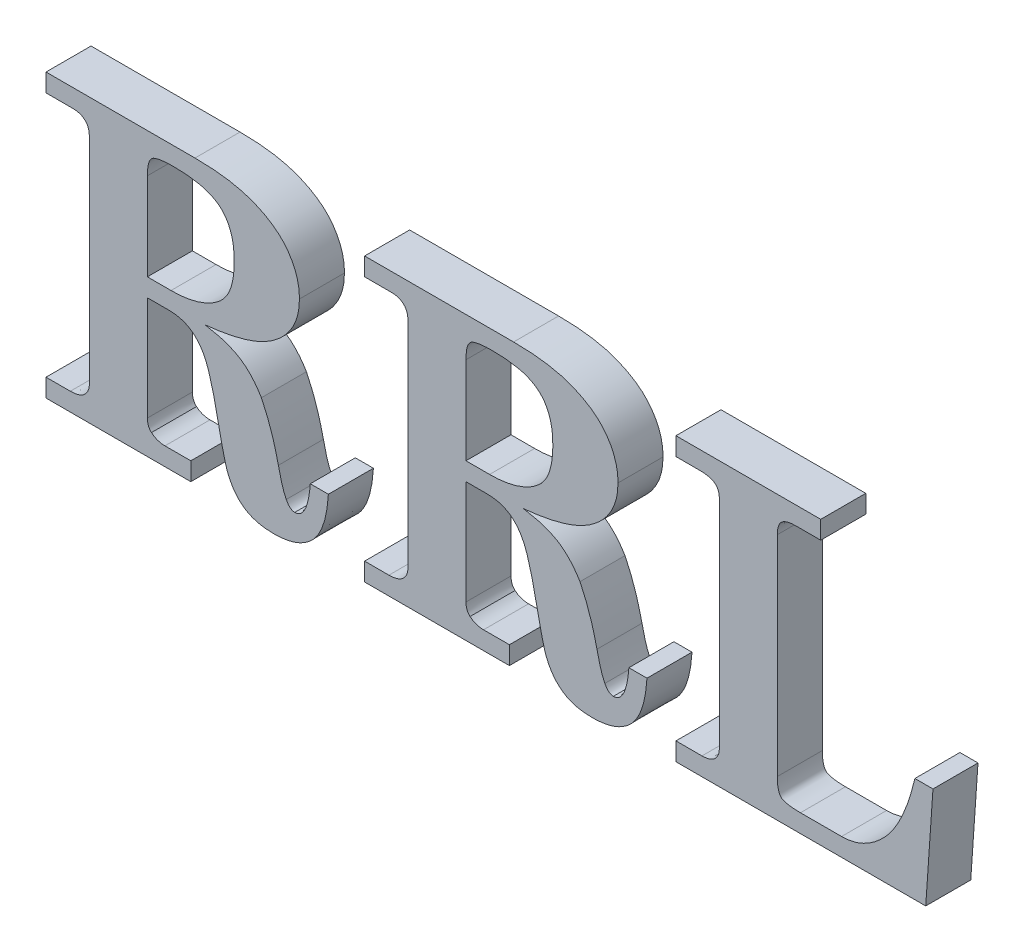
from build123d import *

# Parameters (mm, degrees)
BOSS_EXTRUDE3_DEPTH   = 1.5
BOSS_EXTRUDE3_2_DEPTH = 1.5
BOSS_EXTRUDE3_3_DEPTH = 1.5


with BuildPart() as part:
    # Sketch1 → Boss-Extrude3 (new body)
    with BuildSketch(Plane.XY):
        with BuildLine():
            Line((-17.792306251, 4.694080364), (-12.828663192, 4.694080364))
            add(Edge.make_bspline(
                [(-12.828663192, 4.694080364), (-12.730035048, 4.69268479), (-12.537718263, 4.689963537), (-12.255982797, 4.677801675), (-11.988242483, 4.652805171), (-11.734140511, 4.619512844), (-11.494538517, 4.576171505), (-11.268883087, 4.524225789), (-11.058145121, 4.459104871), (-10.859253477, 4.388590104), (-10.675069792, 4.306712483), (-10.502222733, 4.220179261), (-10.341607342, 4.125844226), (-10.193150347, 4.024321409), (-10.056235222, 3.916981361), (-9.933227506, 3.801062135), (-9.821480356, 3.678346195), (-9.690024752, 3.506695514), (-9.553302789, 3.27955363), (-9.434395722, 2.988775318), (-9.362262286, 2.682490406), (-9.354091978, 2.472696616), (-9.349967259, 2.366783789)],
                knots=[0, 0, 0, 0, 1.260796864, 2.458450407, 3.603348749, 4.696868034, 5.733149247, 6.714703153, 7.654483761, 8.551049231, 9.410311666, 10.229003047, 11.020794849, 11.789116025, 12.526438116, 13.242153704, 13.946977727, 14.645554491, 16.003253973, 17.321296627, 18.647676625, 20, 20, 20, 20], degree=3))
            add(Edge.make_bspline(
                [(-9.349967259, 2.366783789), (-9.352915115, 2.282421282), (-9.358718846, 2.116328606), (-9.403198523, 1.873029201), (-9.475953273, 1.64181479), (-9.582018071, 1.42477804), (-9.714914574, 1.219244817), (-9.87845062, 1.026431585), (-10.071550114, 0.846279243), (-10.217451803, 0.741442678), (-10.292192593, 0.687738244)],
                knots=[0, 0, 0, 0, 1.006615866, 1.981822625, 2.942272039, 3.891414032, 4.85650664, 5.856958922, 6.902188287, 8, 8, 8, 8], degree=3))
            add(Edge.make_bspline(
                [(-10.292192593, 0.687738244), (-10.354945799, 0.647601368), (-10.485662323, 0.563995235), (-10.702597759, 0.458250221), (-10.943901912, 0.36445614), (-11.208356068, 0.280038352), (-11.496402328, 0.204938979), (-11.809041036, 0.141087064), (-12.145504873, 0.08850756), (-12.378782769, 0.063611491), (-12.498884325, 0.050793918)],
                knots=[0, 0, 0, 0, 0.770522959, 1.605018928, 2.492419048, 3.448517842, 4.476706657, 5.572020456, 6.749971061, 8, 8, 8, 8], degree=3))
            add(Edge.make_bspline(
                [(-12.498884325, 0.050793918), (-12.379788278, 0.029372201), (-12.154169488, -0.011209682), (-11.839892812, -0.096561194), (-11.569406343, -0.202057221), (-11.335654672, -0.326159924), (-11.131861552, -0.479353737), (-10.94464162, -0.659649319), (-10.770037989, -0.872615442), (-10.668695136, -1.031618858), (-10.616318108, -1.113796595)],
                knots=[0, 0, 0, 0, 1.260855103, 2.388598191, 3.387941535, 4.281421676, 5.137767289, 6.036055688, 6.984974634, 8, 8, 8, 8], degree=3))
            add(Edge.make_bspline(
                [(-10.616318108, -1.113796595), (-10.559190438, -1.234874713), (-10.441391144, -1.484542113), (-10.295579187, -1.886483815), (-10.159783692, -2.320469388), (-10.088014386, -2.624606811), (-10.050982907, -2.781535436)],
                knots=[0, 0, 0, 0, 0.909803941, 1.87604819, 2.904084753, 4, 4, 4, 4], degree=3))
            add(Edge.make_bspline(
                [(-10.050982907, -2.781535436), (-10.029001298, -2.877169179), (-9.988481624, -3.053455088), (-9.924242474, -3.292445708), (-9.859639057, -3.482897869), (-9.810482023, -3.590256235), (-9.789044264, -3.637076039)],
                knots=[0, 0, 0, 0, 1.313125144, 2.420541671, 3.311186147, 4, 4, 4, 4], degree=3))
            add(Edge.make_bspline(
                [(-9.789044264, -3.637076039), (-9.769192875, -3.672128074), (-9.732841944, -3.736313712), (-9.66176857, -3.80918363), (-9.587279901, -3.859395635), (-9.532786937, -3.865772765), (-9.506376664, -3.868863472)],
                knots=[0, 0, 0, 0, 1.257126063, 2.301990172, 3.177051494, 4, 4, 4, 4], degree=3))
            add(Edge.make_bspline(
                [(-9.506376664, -3.868863472), (-9.471090518, -3.8658157), (-9.400935354, -3.859756184), (-9.305037763, -3.802038031), (-9.223379598, -3.713222042), (-9.151739525, -3.591955046), (-9.095678233, -3.436215323), (-9.047053653, -3.248927256), (-9.010177751, -3.027544759), (-8.995814813, -2.868346248), (-8.98815273, -2.783419887)],
                knots=[0, 0, 0, 0, 0.646043871, 1.28445065, 2.005958554, 2.858823567, 3.864198261, 5.050731084, 6.426677019, 8, 8, 8, 8], degree=3))
            Line((-8.98815273, -2.783419887), (-8.385128517, -2.783419887))
            add(Edge.make_bspline(
                [(-8.385128517, -2.783419887), (-8.391709646, -2.872083173), (-8.404394307, -3.042975377), (-8.438233295, -3.289148077), (-8.484232419, -3.515575082), (-8.54562558, -3.722373695), (-8.615332369, -3.911461429), (-8.701288529, -4.080038315), (-8.796379344, -4.230884818), (-8.90768091, -4.359896859), (-9.029375405, -4.473007313), (-9.164636053, -4.568587237), (-9.309465515, -4.652895764), (-9.468477977, -4.718094258), (-9.637695933, -4.771926117), (-9.820037114, -4.805905929), (-10.013282191, -4.829941249), (-10.146379686, -4.832423669), (-10.214930115, -4.833702214)],
                knots=[0, 0, 0, 0, 1.367110356, 2.635008363, 3.819206984, 4.916686227, 5.950176123, 6.913653537, 7.822085834, 8.685534134, 9.526475961, 10.371017135, 11.227791915, 12.098023441, 13.008610734, 13.954046558, 14.946253751, 16, 16, 16, 16], degree=3))
            add(Edge.make_bspline(
                [(-10.214930115, -4.833702214), (-10.310640748, -4.831337975), (-10.49268334, -4.82684117), (-10.751635839, -4.778699019), (-10.981482628, -4.701243513), (-11.182465161, -4.58904447), (-11.356990463, -4.447215044), (-11.506201899, -4.274439929), (-11.636686128, -4.075325409), (-11.700818658, -3.926532392), (-11.733797354, -3.850018965)],
                knots=[0, 0, 0, 0, 1.180805118, 2.245903272, 3.239527271, 4.163314747, 5.073219269, 6.002236293, 6.972695423, 8, 8, 8, 8], degree=3))
            add(Edge.make_bspline(
                [(-11.733797354, -3.850018965), (-11.744180505, -3.823122988), (-11.767591704, -3.762479828), (-11.798442847, -3.657509107), (-11.834574551, -3.530239495), (-11.871341085, -3.37904674), (-11.913154194, -3.205137104), (-11.95829466, -3.008001793), (-12.00552331, -2.786893686), (-12.036163711, -2.631453506), (-12.052269517, -2.549748004)],
                knots=[0, 0, 0, 0, 0.51621077, 1.16391579, 1.958305469, 2.886107817, 3.950407662, 5.162257264, 6.508370262, 8, 8, 8, 8], degree=3))
            add(Edge.make_bspline(
                [(-12.052269517, -2.549748004), (-12.071551949, -2.454230549), (-12.108509821, -2.271156044), (-12.164704674, -2.008344253), (-12.220986516, -1.770313557), (-12.275638747, -1.556703362), (-12.328040241, -1.368085193), (-12.378872682, -1.204058947), (-12.426685474, -1.063753232), (-12.49106148, -0.913406195), (-12.576239168, -0.752359693), (-12.689901554, -0.582349032), (-12.821755487, -0.441595355), (-12.966708015, -0.325039593), (-13.130438065, -0.238618742), (-13.309213819, -0.172401513), (-13.507676908, -0.138303147), (-13.645149825, -0.132904883), (-13.716239456, -0.130113346)],
                knots=[0, 0, 0, 0, 1.442191922, 2.764191877, 3.977370359, 5.061944357, 6.027372746, 6.874242926, 7.603428871, 8.219893778, 9.292850582, 10.295949872, 11.236574786, 12.136774613, 13.035292675, 13.964593533, 14.947456001, 16, 16, 16, 16], degree=3))
            Line((-13.716239456, -0.130113346), (-14.415370654, -0.130113346))
            Line((-14.415370654, -0.130113346), (-14.415370654, -3.601271477))
            add(Edge.make_bspline(
                [(-14.415370654, -3.601271477), (-14.4134067, -3.637211191), (-14.409669511, -3.705600522), (-14.385749663, -3.802493755), (-14.34182003, -3.885809065), (-14.300219113, -3.929981447), (-14.279690206, -3.951779301)],
                knots=[0, 0, 0, 0, 1.11562849, 2.122918543, 3.073711999, 4, 4, 4, 4], degree=3))
            add(Edge.make_bspline(
                [(-14.279690206, -3.951779301), (-14.247270745, -3.976472533), (-14.182971728, -4.025447761), (-14.071118206, -4.073196949), (-13.953002788, -4.105539098), (-13.870991596, -4.108545199), (-13.829306496, -4.110073157)],
                knots=[0, 0, 0, 0, 1.000506897, 1.984351599, 2.975475153, 4, 4, 4, 4], degree=3))
            Line((-13.829306496, -4.110073157), (-12.968112541, -4.110073157))
            Line((-12.968112541, -4.110073157), (-12.968112541, -4.713097371))
            Line((-12.968112541, -4.713097371), (-17.792306251, -4.713097371))
            Line((-17.792306251, -4.713097371), (-17.792306251, -4.110073157))
            Line((-17.792306251, -4.110073157), (-16.981992464, -4.110073157))
            add(Edge.make_bspline(
                [(-16.981992464, -4.110073157), (-16.932836032, -4.108473008), (-16.839270557, -4.105427248), (-16.709281524, -4.077409334), (-16.596506243, -4.032215732), (-16.505623963, -3.964749465), (-16.43099492, -3.882349387), (-16.380539326, -3.782007922), (-16.3491856, -3.667849502), (-16.346470008, -3.587046176), (-16.345048138, -3.544737957)],
                knots=[0, 0, 0, 0, 1.215748592, 2.314083659, 3.276082243, 4.200108988, 5.092704252, 6.004076111, 6.954944175, 8, 8, 8, 8], degree=3))
            Line((-16.345048138, -3.544737957), (-16.345048138, 3.525720949))
            add(Edge.make_bspline(
                [(-16.345048138, 3.525720949), (-16.346843318, 3.571061482), (-16.350219459, 3.65633209), (-16.375377311, 3.776129689), (-16.422762143, 3.876234034), (-16.489371648, 3.956645948), (-16.572909876, 4.018208178), (-16.672619092, 4.061756002), (-16.788078551, 4.08532755), (-16.869449753, 4.08908104), (-16.912267789, 4.09105615)],
                knots=[0, 0, 0, 0, 1.186255313, 2.230955505, 3.179282011, 4.054730626, 4.935716216, 5.870269018, 6.87932221, 8, 8, 8, 8], degree=3))
            Line((-16.912267789, 4.09105615), (-17.792306251, 4.09105615))
            Line((-17.792306251, 4.09105615), (-17.792306251, 4.694080364))
        make_face()
        with BuildLine():
            Line((-14.415370654, 0.472910867), (-13.627670275, 0.472910867))
            add(Edge.make_bspline(
                [(-13.627670275, 0.472910867), (-13.542783745, 0.473914274), (-13.37696774, 0.475874313), (-13.135302385, 0.504077351), (-12.906873599, 0.544040665), (-12.692310795, 0.602639287), (-12.492144328, 0.678661815), (-12.303915042, 0.768130696), (-12.131467005, 0.878290888), (-12.026984384, 0.963714444), (-11.975007039, 1.006210406)],
                knots=[0, 0, 0, 0, 1.146952266, 2.240438413, 3.284842864, 4.279918954, 5.24205365, 6.176390374, 7.092802377, 8, 8, 8, 8], degree=3))
            add(Edge.make_bspline(
                [(-11.975007039, 1.006210406), (-11.938723546, 1.042306543), (-11.865054682, 1.115595005), (-11.773225791, 1.246070918), (-11.693467075, 1.391793391), (-11.629191734, 1.555820611), (-11.581496097, 1.737528157), (-11.545465861, 1.935924705), (-11.525297906, 2.152170116), (-11.52237453, 2.302043517), (-11.520854428, 2.379974943)],
                knots=[0, 0, 0, 0, 0.823637118, 1.672286907, 2.560369197, 3.496721298, 4.503762865, 5.584178681, 6.743817119, 8, 8, 8, 8], degree=3))
            add(Edge.make_bspline(
                [(-11.520854428, 2.379974943), (-11.522333404, 2.451638634), (-11.525194102, 2.590253616), (-11.546187036, 2.790577241), (-11.579453156, 2.976795688), (-11.627564746, 3.148346179), (-11.692186024, 3.304251237), (-11.770275011, 3.444960163), (-11.859922675, 3.572695345), (-11.968023791, 3.683639824), (-12.091998332, 3.780973477), (-12.236157774, 3.86459383), (-12.400137291, 3.935166974), (-12.584788387, 3.994504963), (-12.790476237, 4.035623211), (-13.015703633, 4.067440677), (-13.261040592, 4.089185423), (-13.43163789, 4.090416601), (-13.520256587, 4.09105615)],
                knots=[0, 0, 0, 0, 1.12607714, 2.178106663, 3.161725867, 4.096006619, 4.972319557, 5.807464053, 6.621093994, 7.416983527, 8.232587358, 9.090979501, 10.028176308, 11.033452721, 12.133172423, 13.319842628, 14.607761926, 16, 16, 16, 16], degree=3))
            add(Edge.make_bspline(
                [(-13.520256587, 4.09105615), (-13.567365457, 4.09065855), (-13.656596672, 4.089905436), (-13.784361509, 4.08527532), (-13.897865454, 4.072701244), (-13.998495739, 4.06183367), (-14.08405251, 4.041069502), (-14.1578209, 4.022858489), (-14.217143327, 3.995852348), (-14.281222082, 3.955181034), (-14.339453129, 3.873158922), (-14.385168622, 3.745464093), (-14.411243965, 3.579476193), (-14.413905505, 3.456082779), (-14.415370654, 3.388156051)],
                knots=[0, 0, 0, 0, 1.234073475, 2.337518953, 3.345986092, 4.225559855, 4.983998792, 5.650694609, 6.210333431, 6.684906202, 7.622862998, 8.768671454, 10.221188891, 12, 12, 12, 12], degree=3))
            Line((-14.415370654, 3.388156051), (-14.415370654, 0.472910867))
        make_face(mode=Mode.SUBTRACT)
    extrude(amount=BOSS_EXTRUDE3_DEPTH)


with BuildPart() as body_2:
    # Sketch1 → Boss-Extrude3 2 (new body)
    with BuildSketch(Plane.XY):
        with BuildLine():
            Line((-7.179080089, 4.694080364), (-2.21543703, 4.694080364))
            add(Edge.make_bspline(
                [(-2.21543703, 4.694080364), (-2.116808886, 4.69268479), (-1.924492101, 4.689963537), (-1.642756635, 4.677801675), (-1.375016321, 4.652805171), (-1.120914349, 4.619512844), (-0.881312355, 4.576171505), (-0.655656926, 4.524225789), (-0.444918959, 4.459104871), (-0.246027315, 4.388590104), (-0.06184363, 4.306712483), (0.111003429, 4.220179261), (0.27161882, 4.125844226), (0.420075815, 4.024321409), (0.556990939, 3.916981361), (0.679998656, 3.801062135), (0.791745806, 3.678346195), (0.92320141, 3.506695514), (1.059923373, 3.27955363), (1.17883044, 2.988775318), (1.250963876, 2.682490406), (1.259134184, 2.472696616), (1.263258903, 2.366783789)],
                knots=[0, 0, 0, 0, 1.260796864, 2.458450407, 3.603348749, 4.696868034, 5.733149247, 6.714703153, 7.654483761, 8.551049231, 9.410311666, 10.229003047, 11.020794849, 11.789116025, 12.526438116, 13.242153704, 13.946977727, 14.645554491, 16.003253973, 17.321296627, 18.647676625, 20, 20, 20, 20], degree=3))
            add(Edge.make_bspline(
                [(1.263258903, 2.366783789), (1.260311047, 2.282421282), (1.254507316, 2.116328606), (1.210027639, 1.873029201), (1.137272889, 1.64181479), (1.031208091, 1.42477804), (0.898311588, 1.219244817), (0.734775541, 1.026431585), (0.541676048, 0.846279243), (0.395774359, 0.741442678), (0.321033569, 0.687738244)],
                knots=[0, 0, 0, 0, 1.006615866, 1.981822625, 2.942272039, 3.891414032, 4.85650664, 5.856958922, 6.902188287, 8, 8, 8, 8], degree=3))
            add(Edge.make_bspline(
                [(0.321033569, 0.687738244), (0.258280363, 0.647601368), (0.127563839, 0.563995235), (-0.089371597, 0.458250221), (-0.33067575, 0.36445614), (-0.595129906, 0.280038352), (-0.883176166, 0.204938979), (-1.195814874, 0.141087064), (-1.532278711, 0.08850756), (-1.765556607, 0.063611491), (-1.885658163, 0.050793918)],
                knots=[0, 0, 0, 0, 0.770522959, 1.605018928, 2.492419048, 3.448517842, 4.476706657, 5.572020456, 6.749971061, 8, 8, 8, 8], degree=3))
            add(Edge.make_bspline(
                [(-1.885658163, 0.050793918), (-1.766562116, 0.029372201), (-1.540943327, -0.011209682), (-1.22666665, -0.096561194), (-0.956180181, -0.202057221), (-0.722428511, -0.326159924), (-0.51863539, -0.479353737), (-0.331415458, -0.659649319), (-0.156811828, -0.872615442), (-0.055468974, -1.031618858), (-0.003091946, -1.113796595)],
                knots=[0, 0, 0, 0, 1.260855103, 2.388598191, 3.387941535, 4.281421676, 5.137767289, 6.036055688, 6.984974634, 8, 8, 8, 8], degree=3))
            add(Edge.make_bspline(
                [(-0.003091946, -1.113796595), (0.054035724, -1.234874713), (0.171835018, -1.484542113), (0.317646975, -1.886483815), (0.453442469, -2.320469388), (0.525211776, -2.624606811), (0.562243255, -2.781535436)],
                knots=[0, 0, 0, 0, 0.909803941, 1.87604819, 2.904084753, 4, 4, 4, 4], degree=3))
            add(Edge.make_bspline(
                [(0.562243255, -2.781535436), (0.584224864, -2.877169179), (0.624744537, -3.053455088), (0.688983688, -3.292445708), (0.753587105, -3.482897869), (0.802744139, -3.590256235), (0.824181898, -3.637076039)],
                knots=[0, 0, 0, 0, 1.313125144, 2.420541671, 3.311186147, 4, 4, 4, 4], degree=3))
            add(Edge.make_bspline(
                [(0.824181898, -3.637076039), (0.844033287, -3.672128074), (0.880384218, -3.736313712), (0.951457592, -3.80918363), (1.025946261, -3.859395635), (1.080439225, -3.865772765), (1.106849498, -3.868863472)],
                knots=[0, 0, 0, 0, 1.257126063, 2.301990172, 3.177051494, 4, 4, 4, 4], degree=3))
            add(Edge.make_bspline(
                [(1.106849498, -3.868863472), (1.142135644, -3.8658157), (1.212290808, -3.859756184), (1.308188399, -3.802038031), (1.389846564, -3.713222042), (1.461486637, -3.591955046), (1.517547929, -3.436215323), (1.566172509, -3.248927256), (1.603048411, -3.027544759), (1.617411349, -2.868346248), (1.625073431, -2.783419887)],
                knots=[0, 0, 0, 0, 0.646043871, 1.28445065, 2.005958554, 2.858823567, 3.864198261, 5.050731084, 6.426677019, 8, 8, 8, 8], degree=3))
            Line((1.625073431, -2.783419887), (2.228097645, -2.783419887))
            add(Edge.make_bspline(
                [(2.228097645, -2.783419887), (2.221516516, -2.872083173), (2.208831855, -3.042975377), (2.174992867, -3.289148077), (2.128993743, -3.515575082), (2.067600581, -3.722373695), (1.997893792, -3.911461429), (1.911937633, -4.080038315), (1.816846817, -4.230884818), (1.705545252, -4.359896859), (1.583850757, -4.473007313), (1.448590109, -4.568587237), (1.303760647, -4.652895764), (1.144748185, -4.718094258), (0.975530229, -4.771926117), (0.793189048, -4.805905929), (0.599943971, -4.829941249), (0.466846476, -4.832423669), (0.398296047, -4.833702214)],
                knots=[0, 0, 0, 0, 1.367110356, 2.635008363, 3.819206984, 4.916686227, 5.950176123, 6.913653537, 7.822085834, 8.685534134, 9.526475961, 10.371017135, 11.227791915, 12.098023441, 13.008610734, 13.954046558, 14.946253751, 16, 16, 16, 16], degree=3))
            add(Edge.make_bspline(
                [(0.398296047, -4.833702214), (0.302585414, -4.831337975), (0.120542822, -4.82684117), (-0.138409677, -4.778699019), (-0.368256466, -4.701243513), (-0.569238999, -4.58904447), (-0.743764302, -4.447215044), (-0.892975737, -4.274439929), (-1.023459966, -4.075325409), (-1.087592496, -3.926532392), (-1.120571192, -3.850018965)],
                knots=[0, 0, 0, 0, 1.180805118, 2.245903272, 3.239527271, 4.163314747, 5.073219269, 6.002236293, 6.972695423, 8, 8, 8, 8], degree=3))
            add(Edge.make_bspline(
                [(-1.120571192, -3.850018965), (-1.130954343, -3.823122988), (-1.154365543, -3.762479828), (-1.185216685, -3.657509107), (-1.221348389, -3.530239495), (-1.258114923, -3.37904674), (-1.299928032, -3.205137104), (-1.345068498, -3.008001793), (-1.392297149, -2.786893686), (-1.422937549, -2.631453506), (-1.439043355, -2.549748004)],
                knots=[0, 0, 0, 0, 0.51621077, 1.16391579, 1.958305469, 2.886107817, 3.950407662, 5.162257264, 6.508370262, 8, 8, 8, 8], degree=3))
            add(Edge.make_bspline(
                [(-1.439043355, -2.549748004), (-1.458325788, -2.454230549), (-1.495283659, -2.271156044), (-1.551478512, -2.008344253), (-1.607760354, -1.770313557), (-1.662412586, -1.556703362), (-1.714814079, -1.368085193), (-1.76564652, -1.204058947), (-1.813459312, -1.063753232), (-1.877835318, -0.913406195), (-1.963013006, -0.752359693), (-2.076675392, -0.582349032), (-2.208529325, -0.441595355), (-2.353481854, -0.325039593), (-2.517211903, -0.238618742), (-2.695987658, -0.172401513), (-2.894450746, -0.138303147), (-3.031923664, -0.132904883), (-3.103013294, -0.130113346)],
                knots=[0, 0, 0, 0, 1.442191922, 2.764191877, 3.977370359, 5.061944357, 6.027372746, 6.874242926, 7.603428871, 8.219893778, 9.292850582, 10.295949872, 11.236574786, 12.136774613, 13.035292675, 13.964593533, 14.947456001, 16, 16, 16, 16], degree=3))
            Line((-3.103013294, -0.130113346), (-3.802144492, -0.130113346))
            Line((-3.802144492, -0.130113346), (-3.802144492, -3.601271477))
            add(Edge.make_bspline(
                [(-3.802144492, -3.601271477), (-3.800180538, -3.637211191), (-3.796443349, -3.705600522), (-3.772523501, -3.802493755), (-3.728593868, -3.885809065), (-3.686992951, -3.929981447), (-3.666464044, -3.951779301)],
                knots=[0, 0, 0, 0, 1.11562849, 2.122918543, 3.073711999, 4, 4, 4, 4], degree=3))
            add(Edge.make_bspline(
                [(-3.666464044, -3.951779301), (-3.634044583, -3.976472533), (-3.569745566, -4.025447761), (-3.457892044, -4.073196949), (-3.339776626, -4.105539098), (-3.257765434, -4.108545199), (-3.216080335, -4.110073157)],
                knots=[0, 0, 0, 0, 1.000506897, 1.984351599, 2.975475153, 4, 4, 4, 4], degree=3))
            Line((-3.216080335, -4.110073157), (-2.354886379, -4.110073157))
            Line((-2.354886379, -4.110073157), (-2.354886379, -4.713097371))
            Line((-2.354886379, -4.713097371), (-7.179080089, -4.713097371))
            Line((-7.179080089, -4.713097371), (-7.179080089, -4.110073157))
            Line((-7.179080089, -4.110073157), (-6.368766302, -4.110073157))
            add(Edge.make_bspline(
                [(-6.368766302, -4.110073157), (-6.319609871, -4.108473008), (-6.226044395, -4.105427248), (-6.096055362, -4.077409334), (-5.983280081, -4.032215732), (-5.892397801, -3.964749465), (-5.817768759, -3.882349387), (-5.767313164, -3.782007922), (-5.735959438, -3.667849502), (-5.733243846, -3.587046176), (-5.731821976, -3.544737957)],
                knots=[0, 0, 0, 0, 1.215748592, 2.314083659, 3.276082243, 4.200108988, 5.092704252, 6.004076111, 6.954944175, 8, 8, 8, 8], degree=3))
            Line((-5.731821976, -3.544737957), (-5.731821976, 3.525720949))
            add(Edge.make_bspline(
                [(-5.731821976, 3.525720949), (-5.733617156, 3.571061482), (-5.736993297, 3.65633209), (-5.762151149, 3.776129689), (-5.809535981, 3.876234034), (-5.876145486, 3.956645948), (-5.959683715, 4.018208178), (-6.05939293, 4.061756002), (-6.174852389, 4.08532755), (-6.256223591, 4.08908104), (-6.299041627, 4.09105615)],
                knots=[0, 0, 0, 0, 1.186255313, 2.230955505, 3.179282011, 4.054730626, 4.935716216, 5.870269018, 6.87932221, 8, 8, 8, 8], degree=3))
            Line((-6.299041627, 4.09105615), (-7.179080089, 4.09105615))
            Line((-7.179080089, 4.09105615), (-7.179080089, 4.694080364))
        make_face()
        with BuildLine():
            Line((-3.802144492, 0.472910867), (-3.014444113, 0.472910867))
            add(Edge.make_bspline(
                [(-3.014444113, 0.472910867), (-2.929557583, 0.473914274), (-2.763741578, 0.475874313), (-2.522076223, 0.504077351), (-2.293647437, 0.544040665), (-2.079084634, 0.602639287), (-1.878918166, 0.678661815), (-1.69068888, 0.768130696), (-1.518240843, 0.878290888), (-1.413758222, 0.963714444), (-1.361780877, 1.006210406)],
                knots=[0, 0, 0, 0, 1.146952266, 2.240438413, 3.284842864, 4.279918954, 5.24205365, 6.176390374, 7.092802377, 8, 8, 8, 8], degree=3))
            add(Edge.make_bspline(
                [(-1.361780877, 1.006210406), (-1.325497384, 1.042306543), (-1.25182852, 1.115595005), (-1.159999629, 1.246070918), (-1.080240914, 1.391793391), (-1.015965572, 1.555820611), (-0.968269935, 1.737528157), (-0.932239699, 1.935924705), (-0.912071744, 2.152170116), (-0.909148368, 2.302043517), (-0.907628266, 2.379974943)],
                knots=[0, 0, 0, 0, 0.823637118, 1.672286907, 2.560369197, 3.496721298, 4.503762865, 5.584178681, 6.743817119, 8, 8, 8, 8], degree=3))
            add(Edge.make_bspline(
                [(-0.907628266, 2.379974943), (-0.909107242, 2.451638634), (-0.91196794, 2.590253616), (-0.932960874, 2.790577241), (-0.966226994, 2.976795688), (-1.014338584, 3.148346179), (-1.078959862, 3.304251237), (-1.157048849, 3.444960163), (-1.246696513, 3.572695345), (-1.354797629, 3.683639824), (-1.47877217, 3.780973477), (-1.622931612, 3.86459383), (-1.786911129, 3.935166974), (-1.971562225, 3.994504963), (-2.177250075, 4.035623211), (-2.402477472, 4.067440677), (-2.64781443, 4.089185423), (-2.818411728, 4.090416601), (-2.907030425, 4.09105615)],
                knots=[0, 0, 0, 0, 1.12607714, 2.178106663, 3.161725867, 4.096006619, 4.972319557, 5.807464053, 6.621093994, 7.416983527, 8.232587358, 9.090979501, 10.028176308, 11.033452721, 12.133172423, 13.319842628, 14.607761926, 16, 16, 16, 16], degree=3))
            add(Edge.make_bspline(
                [(-2.907030425, 4.09105615), (-2.954139295, 4.09065855), (-3.04337051, 4.089905436), (-3.171135347, 4.08527532), (-3.284639292, 4.072701244), (-3.385269577, 4.06183367), (-3.470826349, 4.041069502), (-3.544594738, 4.022858489), (-3.603917165, 3.995852348), (-3.667995921, 3.955181034), (-3.726226967, 3.873158922), (-3.77194246, 3.745464093), (-3.798017803, 3.579476193), (-3.800679344, 3.456082779), (-3.802144492, 3.388156051)],
                knots=[0, 0, 0, 0, 1.234073475, 2.337518953, 3.345986092, 4.225559855, 4.983998792, 5.650694609, 6.210333431, 6.684906202, 7.622862998, 8.768671454, 10.221188891, 12, 12, 12, 12], degree=3))
            Line((-3.802144492, 3.388156051), (-3.802144492, 0.472910867))
        make_face(mode=Mode.SUBTRACT)
    extrude(amount=BOSS_EXTRUDE3_2_DEPTH)


with BuildPart() as body_3:
    # Sketch1 → Boss-Extrude3 3 (new body)
    with BuildSketch(Plane.XY):
        with BuildLine():
            Line((3.192936387, 4.09105615), (3.192936387, 4.694080364))
            Line((3.192936387, 4.694080364), (8.017130097, 4.694080364))
            Line((8.017130097, 4.694080364), (8.017130097, 4.09105615))
            Line((8.017130097, 4.09105615), (7.201162958, 4.09105615))
            add(Edge.make_bspline(
                [(7.201162958, 4.09105615), (7.146973951, 4.090316088), (7.046617629, 4.088945518), (6.909040116, 4.06159252), (6.795280703, 4.022888411), (6.706358165, 3.961932334), (6.644295644, 3.879770462), (6.600242309, 3.779968207), (6.574808555, 3.659493898), (6.571591963, 3.572329539), (6.569871984, 3.525720949)],
                knots=[0, 0, 0, 0, 1.317174052, 2.439364582, 3.40274332, 4.226216974, 5.021934816, 5.877883306, 6.86526021, 8, 8, 8, 8], degree=3))
            Line((6.569871984, 3.525720949), (6.569871984, -3.450515423))
            add(Edge.make_bspline(
                [(6.569871984, -3.450515423), (6.57055665, -3.514712935), (6.57179927, -3.63122679), (6.597960919, -3.7874249), (6.636326908, -3.908278473), (6.699206161, -4.001156735), (6.805184591, -4.053332368), (6.944300643, -4.084973797), (7.127668663, -4.107310775), (7.264537266, -4.109086284), (7.340612307, -4.110073157)],
                knots=[0, 0, 0, 0, 1.253318516, 2.274682744, 3.08242206, 3.723352428, 4.399534733, 5.325689848, 6.513550565, 8, 8, 8, 8], degree=3))
            Line((7.340612307, -4.110073157), (8.710607943, -4.110073157))
            add(Edge.make_bspline(
                [(8.710607943, -4.110073157), (8.774196891, -4.107813113), (8.900916578, -4.103309309), (9.088482055, -4.069573159), (9.273409036, -4.017936482), (9.452301592, -3.937751425), (9.630968616, -3.84256209), (9.804163292, -3.722315309), (9.974756981, -3.581589291), (10.142254974, -3.420077175), (10.303664877, -3.234349785), (10.454222701, -3.021858041), (10.595476305, -2.78340579), (10.726694821, -2.519102699), (10.848746657, -2.230053554), (10.962695749, -1.915953976), (11.06291837, -1.574815479), (11.122294252, -1.337636769), (11.152856009, -1.215556931)],
                knots=[0, 0, 0, 0, 0.746952398, 1.488522408, 2.233867827, 2.997739128, 3.787258218, 4.610437708, 5.470623944, 6.384302497, 7.342016262, 8.35813022, 9.440650158, 10.596202486, 11.823439516, 13.126538548, 14.520981459, 16, 16, 16, 16], degree=3))
            Line((11.152856009, -1.215556931), (11.755880222, -1.215556931))
            Line((11.755880222, -1.215556931), (11.514670537, -4.713097371))
            Line((11.514670537, -4.713097371), (3.192936387, -4.713097371))
            Line((3.192936387, -4.713097371), (3.192936387, -4.110073157))
            Line((3.192936387, -4.110073157), (4.059783694, -4.110073157))
            add(Edge.make_bspline(
                [(4.059783694, -4.110073157), (4.104498004, -4.108245137), (4.189755831, -4.104759609), (4.308944355, -4.0794974), (4.410600275, -4.03480302), (4.495955675, -3.974554994), (4.560228104, -3.894636623), (4.609513005, -3.802464748), (4.634853636, -3.693646282), (4.638352308, -3.617085804), (4.6401945, -3.576773618)],
                knots=[0, 0, 0, 0, 1.195528741, 2.279542841, 3.234602015, 4.14844858, 5.043106676, 5.952155301, 6.921726988, 8, 8, 8, 8], degree=3))
            Line((4.6401945, -3.576773618), (4.6401945, 3.595445624))
            add(Edge.make_bspline(
                [(4.6401945, 3.595445624), (4.638609579, 3.635825536), (4.635617158, 3.712065072), (4.607648576, 3.817968758), (4.559445496, 3.906473262), (4.489940552, 3.97757991), (4.39734584, 4.031857404), (4.2783633, 4.065250351), (4.134770703, 4.087822032), (4.029745137, 4.089922987), (3.973098964, 4.09105615)],
                knots=[0, 0, 0, 0, 1.00990991, 1.906766507, 2.716615905, 3.506507968, 4.367174043, 5.37229384, 6.582730811, 8, 8, 8, 8], degree=3))
            Line((3.973098964, 4.09105615), (3.192936387, 4.09105615))
        make_face()
    extrude(amount=BOSS_EXTRUDE3_3_DEPTH)


solid = Compound([part.part, body_2.part, body_3.part])
